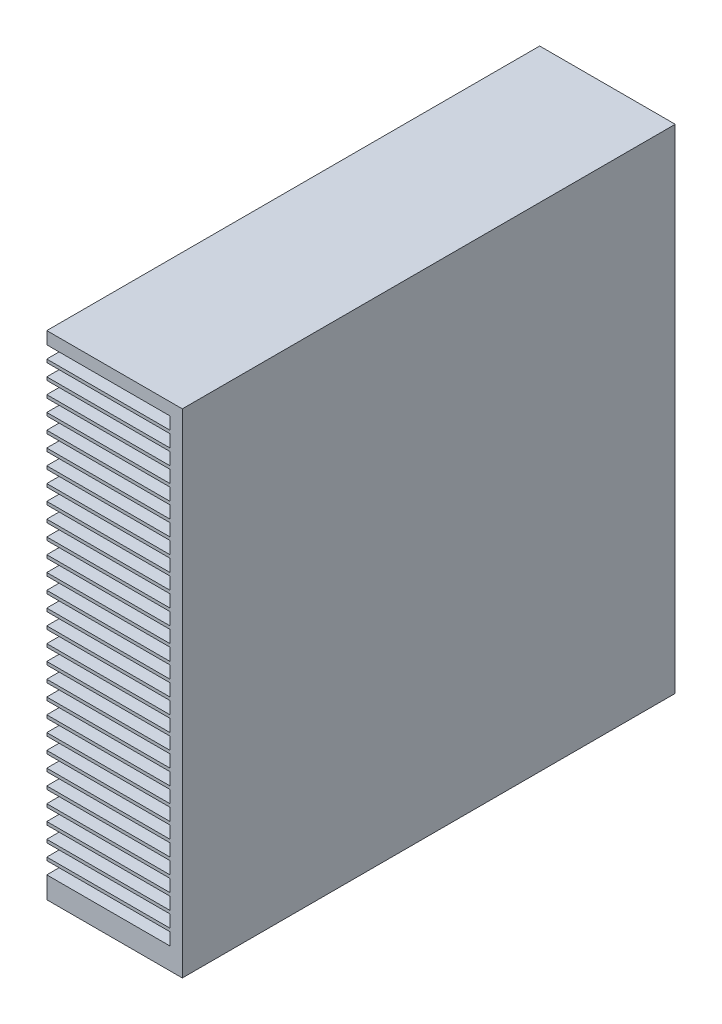
from build123d import *

# Parameters (mm, degrees)
SKETCH1_W           = 11
SKETCH1_H           = 40
BOSS_EXTRUDE1_DEPTH = 20
SKETCH2_W           = 10
SKETCH2_H           = 1
CUT_EXTRUDE2_DEPTH  = 40


with BuildPart() as part:
    # Sketch1 → Boss-Extrude1 (new, symmetric)
    with BuildSketch(Plane.XY):
        Rectangle(SKETCH1_W, SKETCH1_H)
    extrude(amount=BOSS_EXTRUDE1_DEPTH, both=True)

    # Sketch2 → Cut-Extrude2 (cut)
    with BuildSketch(Plane.XY.offset(20)):
        with Locations((-0.5, 18.5)):
            Rectangle(SKETCH2_W, SKETCH2_H)
        with Locations((-0.5, 17.250002203)):
            Rectangle(SKETCH2_W, SKETCH2_H)
        with Locations((-0.5, 16.000004405)):
            Rectangle(SKETCH2_W, SKETCH2_H)
        with Locations((-0.5, 14.750006608)):
            Rectangle(SKETCH2_W, SKETCH2_H)
        with Locations((-0.5, 13.50000881)):
            Rectangle(SKETCH2_W, SKETCH2_H)
        with Locations((-0.5, 12.250011013)):
            Rectangle(SKETCH2_W, SKETCH2_H)
        with Locations((-0.5, 11.000013216)):
            Rectangle(SKETCH2_W, SKETCH2_H)
        with Locations((-0.5, 9.750015418)):
            Rectangle(SKETCH2_W, SKETCH2_H)
        with Locations((-0.5, 8.500017621)):
            Rectangle(SKETCH2_W, SKETCH2_H)
        with Locations((-0.5, 7.250019823)):
            Rectangle(SKETCH2_W, SKETCH2_H)
        with Locations((-0.5, 6.000022026)):
            Rectangle(SKETCH2_W, SKETCH2_H)
        with Locations((-0.5, 4.750024229)):
            Rectangle(SKETCH2_W, SKETCH2_H)
        with Locations((-0.5, 3.500026431)):
            Rectangle(SKETCH2_W, SKETCH2_H)
        with Locations((-0.5, 2.250028634)):
            Rectangle(SKETCH2_W, SKETCH2_H)
        with Locations((-0.5, 1.000030836)):
            Rectangle(SKETCH2_W, SKETCH2_H)
        with Locations((-0.5, -0.249966961)):
            Rectangle(SKETCH2_W, SKETCH2_H)
        with Locations((-0.5, -1.499964758)):
            Rectangle(SKETCH2_W, SKETCH2_H)
        with Locations((-0.5, -2.749962556)):
            Rectangle(SKETCH2_W, SKETCH2_H)
        with Locations((-0.5, -3.999960353)):
            Rectangle(SKETCH2_W, SKETCH2_H)
        with Locations((-0.5, -5.249958151)):
            Rectangle(SKETCH2_W, SKETCH2_H)
        with Locations((-0.5, -6.499955948)):
            Rectangle(SKETCH2_W, SKETCH2_H)
        with Locations((-0.5, -7.749953745)):
            Rectangle(SKETCH2_W, SKETCH2_H)
        with Locations((-0.5, -8.999951543)):
            Rectangle(SKETCH2_W, SKETCH2_H)
        with Locations((-0.5, -10.24994934)):
            Rectangle(SKETCH2_W, SKETCH2_H)
        with Locations((-0.5, -11.499947138)):
            Rectangle(SKETCH2_W, SKETCH2_H)
        with Locations((-0.5, -12.749944935)):
            Rectangle(SKETCH2_W, SKETCH2_H)
        with Locations((-0.5, -13.999942732)):
            Rectangle(SKETCH2_W, SKETCH2_H)
        with Locations((-0.5, -15.24994053)):
            Rectangle(SKETCH2_W, SKETCH2_H)
        with Locations((-0.5, -16.499938327)):
            Rectangle(SKETCH2_W, SKETCH2_H)
        with Locations((-0.5, -17.749936125)):
            Rectangle(SKETCH2_W, SKETCH2_H)
    extrude(amount=-CUT_EXTRUDE2_DEPTH, mode=Mode.SUBTRACT)


solid = part.part
